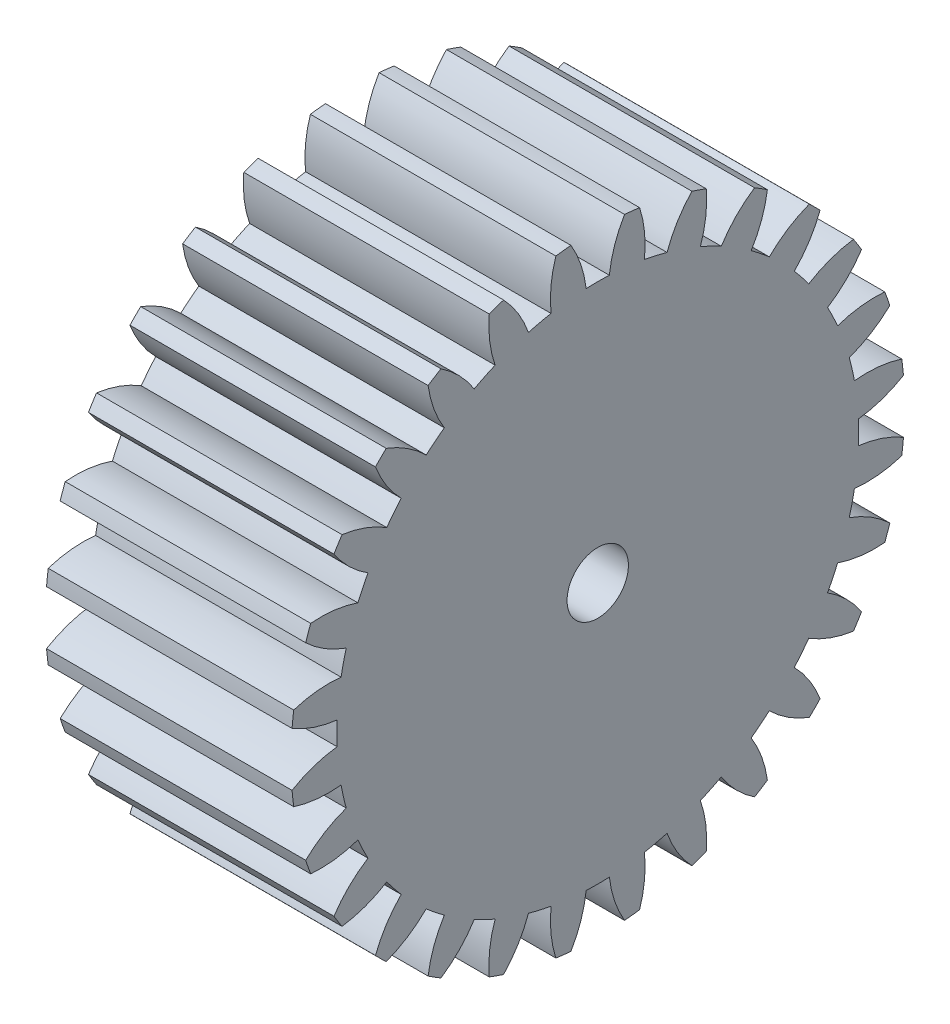
from build123d import *

# Parameters (mm, degrees)
BASPROSKE_W     = 12.7
BASPROSKE_H     = 15.875
TOOTHCUT_DEPTH  = 26.793821935
TEETHCUTS_COUNT = 28
TEETHCUTS_ANGLE = 347.142857143
BORSKE_R        = 1.5875
BORE_DEPTH      = 50.8000508


with BuildPart() as part:
    # BasProSke → Base-Revolve (revolve)
    with BuildSketch(Plane(origin=(0, 0, 0), x_dir=(1, 0, 0), z_dir=(0, 1, 0)), mode=Mode.PRIVATE) as base_revolve_sk:
        with Locations((6.35, 7.9375)):
            Rectangle(BASPROSKE_W, BASPROSKE_H)
    revolve(base_revolve_sk.sketch.rotate(Axis((-10, 0, 0), (1, 0, 0)), 180), axis=Axis((-10, 0, 0), (1, 0, 0)))

    # TooCutSke → ToothCut (cut, through all)
    with BuildSketch(Plane(origin=(0, 0, 0), x_dir=(0, 0, -1), z_dir=(1, 0, 0))):
        with BuildLine():
            ThreePointArc((0.599812378, 13.482531001), (0, 13.495866667), (-0.599812378, 13.482531001))
            ThreePointArc((-0.599812378, 13.482531001), (-0.87547319, 14.703072459), (-1.401240493, 15.838536714))
            ThreePointArc((-1.401240493, 15.838536714), (0, 15.9004), (1.401240493, 15.838536714))
            ThreePointArc((1.401240493, 15.838536714), (0.87547319, 14.703072459), (0.599812378, 13.482531001))
        make_face()
    toothcut = extrude(amount=TOOTHCUT_DEPTH, mode=Mode.SUBTRACT)

    # TeethCuts: ToothCut ×28 about axis
    teethcuts_axis = Axis((-10, 0, 0), (1, 0, 0))
    for i in range(1, TEETHCUTS_COUNT):
        add(toothcut.rotate(teethcuts_axis, i * TEETHCUTS_ANGLE / (TEETHCUTS_COUNT - 1)), mode=Mode.SUBTRACT)

    # BorSke → Bore (cut, symmetric)
    with BuildSketch(Plane(origin=(0, 0, 0), x_dir=(0, 0, -1), z_dir=(1, 0, 0))):
        with Locations(Location((0, 0, 0), (0, 0, 180))):
            Circle(BORSKE_R)
    extrude(amount=BORE_DEPTH, both=True, mode=Mode.SUBTRACT)


solid = part.part
